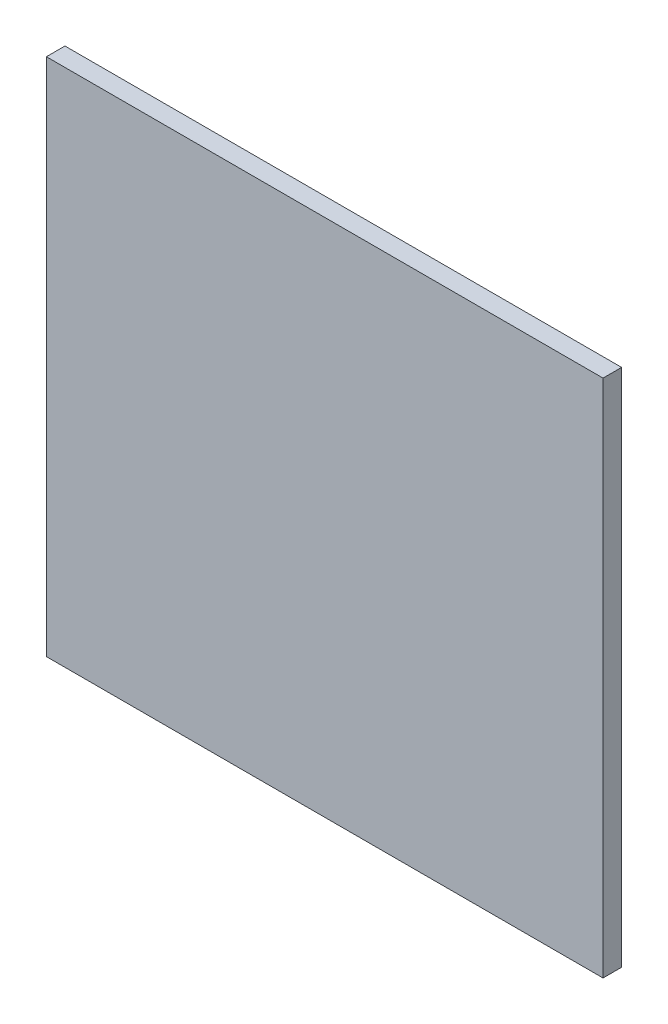
from build123d import *

# Parameters (mm, degrees)
SKETCH1_W           = 30
SKETCH1_H           = 28
BOSS_EXTRUDE1_DEPTH = 1


with BuildPart() as part:
    # Sketch1 → Boss-Extrude1 (new body)
    with BuildSketch(Plane.XY):
        with Locations((15, 14)):
            Rectangle(SKETCH1_W, SKETCH1_H)
    extrude(amount=BOSS_EXTRUDE1_DEPTH)


solid = part.part
